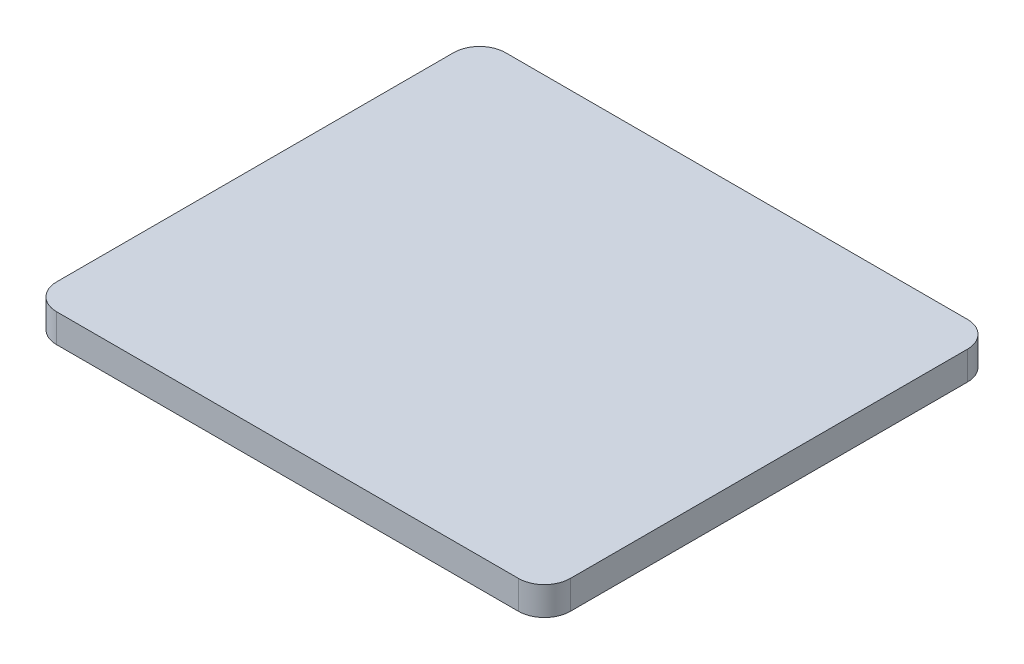
from build123d import *

# Parameters (mm, degrees)
SKETCH1_W           = 198
SKETCH1_H           = 173
BOSS_EXTRUDE1_DEPTH = 11
FILLET1_R           = 10
SKETCH2_W           = 12
SKETCH2_H           = 6.5
SKETCH2_W_2         = 16
SKETCH2_H_2         = 16.1
SKETCH2_H_3         = 6.2
SKETCH2_W_3         = 24
SKETCH2_W_4         = 31
CUT_EXTRUDE1_DEPTH  = 7


with BuildPart() as part:
    # Sketch1 → Boss-Extrude1 (new body)
    with BuildSketch(Plane(origin=(0, 0, 0), x_dir=(1, 0, 0), z_dir=(0, 1, 0))):
        Rectangle(SKETCH1_W, SKETCH1_H)
    extrude(amount=BOSS_EXTRUDE1_DEPTH)

    # Fillet1
    fillet1_edges = [part.edges().sort_by_distance(p)[0] for p in [
        (-99, 5.5, -86.5),
        (99, 5.5, -86.5),
        (99, 5.5, 86.5),
        (-99, 5.5, 86.5),
    ]]
    fillet(fillet1_edges, radius=FILLET1_R)

    # Sketch2 → Cut-Extrude1 (cut)
    with BuildSketch(Plane.XZ):
        with Locations((-65, 54.25)):
            Rectangle(SKETCH2_W, SKETCH2_H)
        with Locations((-36.2, 54.25)):
            Rectangle(SKETCH2_W, SKETCH2_H)
        with Locations((-63, 27.85)):
            Rectangle(SKETCH2_W_2, SKETCH2_H_2)
        with Locations((-63, 9)):
            Rectangle(SKETCH2_W_2, SKETCH2_H_3)
        with Locations((-35.2, 27.85)):
            Rectangle(SKETCH2_W_3, SKETCH2_H_2)
        with Locations((-35.2, 9)):
            Rectangle(SKETCH2_W_3, SKETCH2_H_3)
        with Locations((0, 27.85)):
            Rectangle(SKETCH2_W_4, SKETCH2_H_2)
    cut_extrude1 = extrude(amount=-CUT_EXTRUDE1_DEPTH, mode=Mode.SUBTRACT)

    # Mirror1: Cut-Extrude1 across plane
    add(cut_extrude1.mirror(Plane.ZY), mode=Mode.SUBTRACT)


solid = part.part
